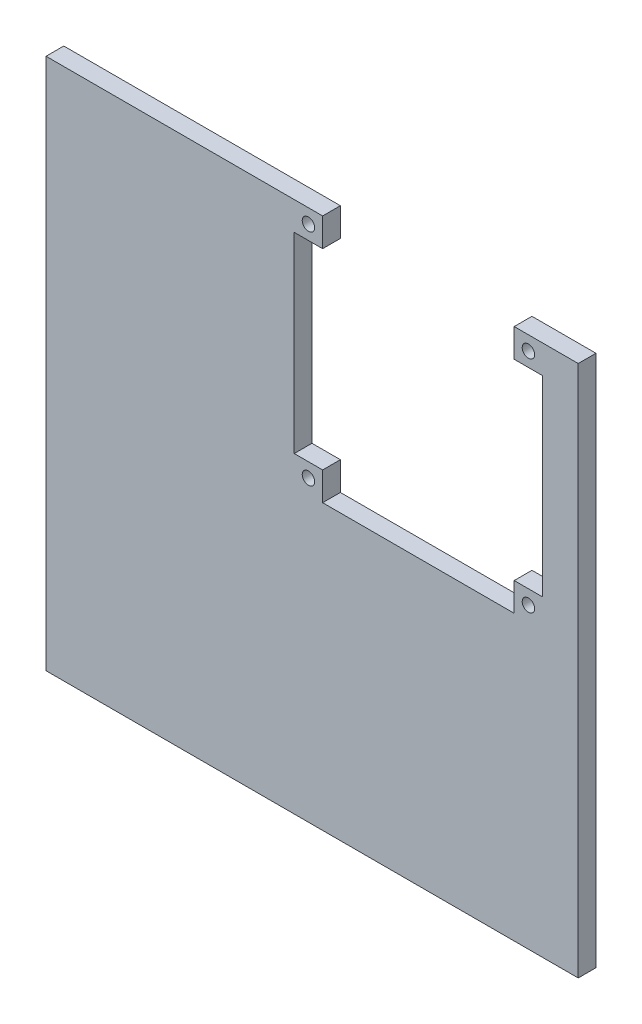
from build123d import *

# Parameters (mm, degrees)
SKETCH1_W           = 150
SKETCH1_H           = 150
BOSS_EXTRUDE1_DEPTH = 5
SKETCH2_R           = 1.75
CUT_EXTRUDE1_DEPTH  = 213.190951739


with BuildPart() as part:
    # Sketch1 → Boss-Extrude1 (new body)
    with BuildSketch(Plane.XY):
        with Locations((75, 75)):
            Rectangle(SKETCH1_W, SKETCH1_H)
    extrude(amount=BOSS_EXTRUDE1_DEPTH)

    # Sketch2 → Cut-Extrude1 (cut, through all)
    with BuildSketch(Plane.XY.offset(5)):
        with Locations((73.960018565, 84)):
            Circle(SKETCH2_R)
        with Locations((73.960018565, 146)):
            Circle(SKETCH2_R)
        with Locations((135.960018565, 146)):
            Circle(SKETCH2_R)
        with Locations((135.960018565, 84)):
            Circle(SKETCH2_R)
        Polygon((77.960018565, 150), (131.960018565, 150), (131.960018565, 142), (139.960018565, 142), (139.960018565, 88), (131.960018565, 88), (131.960018565, 80), (77.960018565, 80), (77.960018565, 88), (69.960018565, 88), (69.960018565, 142), (77.960018565, 142), align=None)
    extrude(amount=-CUT_EXTRUDE1_DEPTH, mode=Mode.SUBTRACT)


solid = part.part
